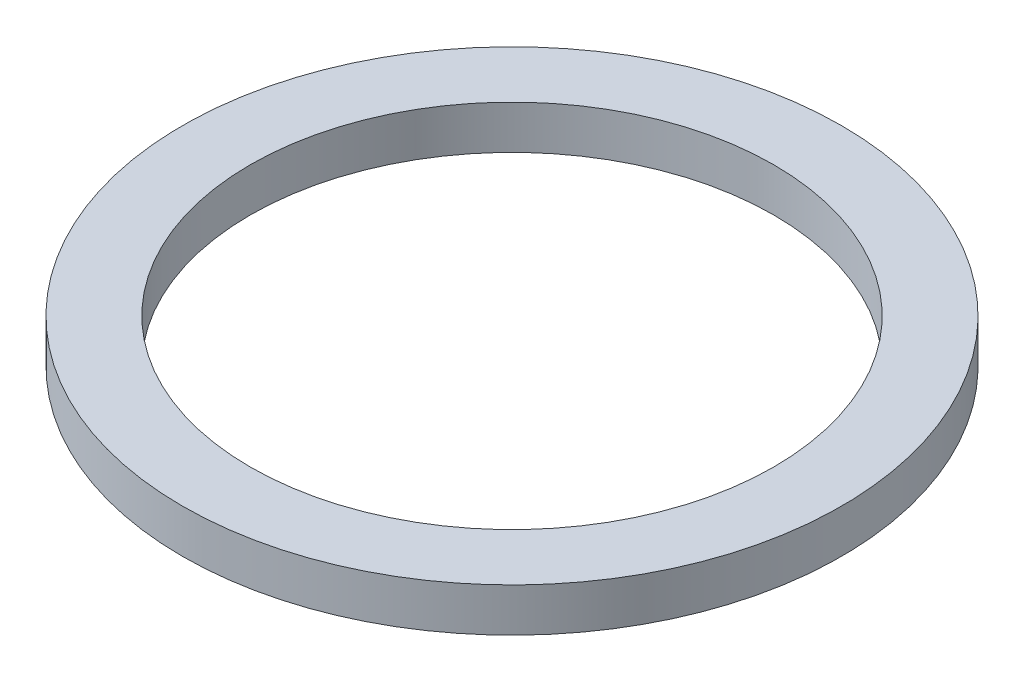
from build123d import *

# Parameters (mm, degrees)
SKETCH2_R           = 13.462
BOSS_EXTRUDE1_DEPTH = 1.778
SKETCH3_R           = 10.6934
CUT_EXTRUDE1_DEPTH  = 20.120987736


with BuildPart() as part:
    # Sketch2 → Boss-Extrude1 (new body)
    with BuildSketch(Plane(origin=(0, 0, 0), x_dir=(1, 0, 0), z_dir=(0, 1, 0))):
        with Locations(Location((0, 0, 0), (0, 0, 270))):
            Circle(SKETCH2_R)
    extrude(amount=BOSS_EXTRUDE1_DEPTH)

    # Sketch3 → Cut-Extrude1 (cut, through all)
    with BuildSketch(Plane(origin=(0, 1.778, 0), x_dir=(1, 0, 0), z_dir=(0, 1, 0))):
        with Locations(Location((0, 0, 0), (0, 0, 270))):
            Circle(SKETCH3_R)
    extrude(amount=-CUT_EXTRUDE1_DEPTH, mode=Mode.SUBTRACT)


solid = part.part
